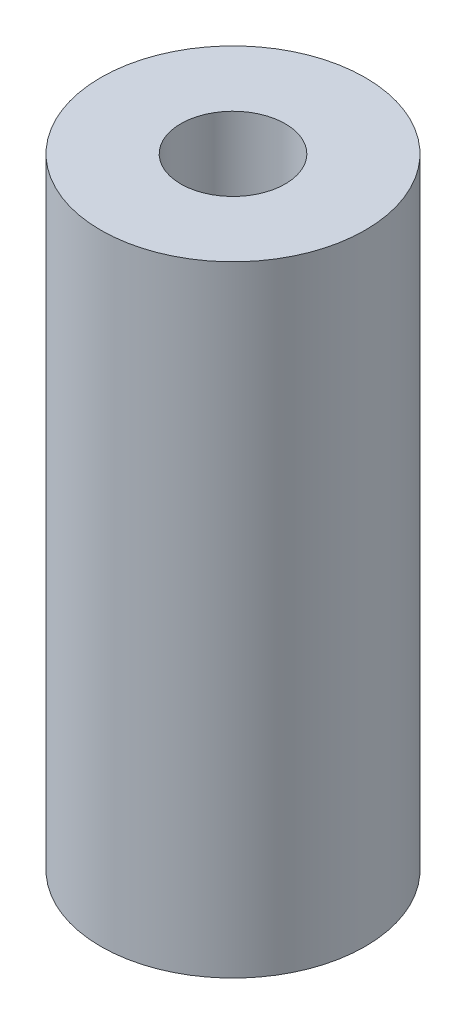
from build123d import *

# Parameters (mm, degrees)
SKETCH1_R           = 4.05
SKETCH1_R_2         = 1.6
BOSS_EXTRUDE1_DEPTH = 19


with BuildPart() as part:
    # Sketch1 → Boss-Extrude1 (new body)
    with BuildSketch(Plane(origin=(0, 0, 0), x_dir=(1, 0, 0), z_dir=(0, 1, 0))):
        with Locations(Location((0, 0, 0), (0, 0, 270))):
            Circle(SKETCH1_R)
        with Locations(Location((0, 0, 0), (0, 0, 270))):
            Circle(SKETCH1_R_2, mode=Mode.SUBTRACT)
    extrude(amount=BOSS_EXTRUDE1_DEPTH)


solid = part.part
